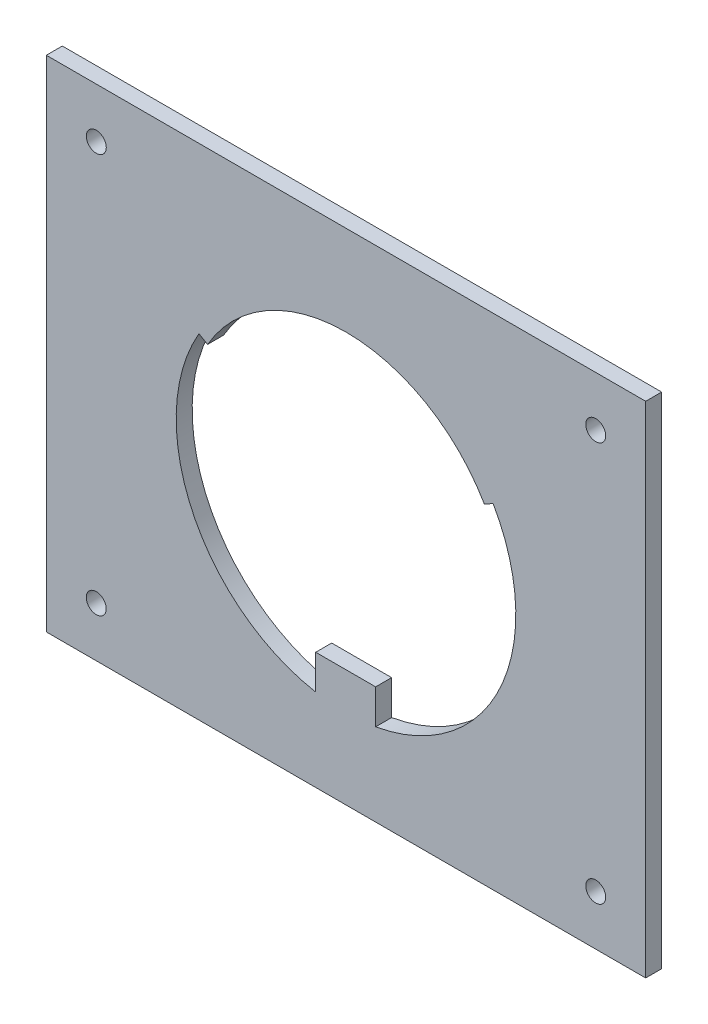
from build123d import *

# Parameters (mm, degrees)
SKETCH1_W           = 60
SKETCH1_H           = 50
SKETCH1_R           = 1
BOSS_EXTRUDE1_DEPTH = 1.6


with BuildPart() as part:
    # Sketch1 → Boss-Extrude1 (new body)
    with BuildSketch(Plane.XY):
        with Locations((2.183616654, 0.548157273)):
            Rectangle(SKETCH1_W, SKETCH1_H)
        with Locations((-22.816383346, 20.548157273)):
            Circle(SKETCH1_R, mode=Mode.SUBTRACT)
        with Locations(Location((27.183616654, 20.548157273, 0), (0, 0, 180))):
            Circle(SKETCH1_R, mode=Mode.SUBTRACT)
        with Locations((27.183616654, -19.451842727)):
            Circle(SKETCH1_R, mode=Mode.SUBTRACT)
        with Locations(Location((-22.816383346, -19.451842727, 0), (0, 0, 180))):
            Circle(SKETCH1_R, mode=Mode.SUBTRACT)
        with BuildLine():
            Line((-0.849639296, -12.726842727), (5.150360704, -12.726842727))
            Line((5.150360704, -12.726842727), (5.150360704, -16.19097143))
            ThreePointArc((5.150360704, -16.19097143), (17.594007322, -6.629576314), (16.906048518, 9.048157273))
            Line((16.906048518, 9.048157273), (16.040023114, 8.548157273))
            ThreePointArc((16.040023114, 8.548157273), (2.183616654, 16.548157273), (-11.672789807, 8.548157273))
            Line((-11.672789807, 8.548157273), (-12.538815211, 9.048157273))
            ThreePointArc((-12.538815211, 9.048157273), (-13.241008775, -6.598935169), (-0.849639296, -16.179046867))
            Line((-0.849639296, -16.179046867), (-0.849639296, -12.726842727))
        make_face(mode=Mode.SUBTRACT)
    extrude(amount=BOSS_EXTRUDE1_DEPTH)


solid = part.part
